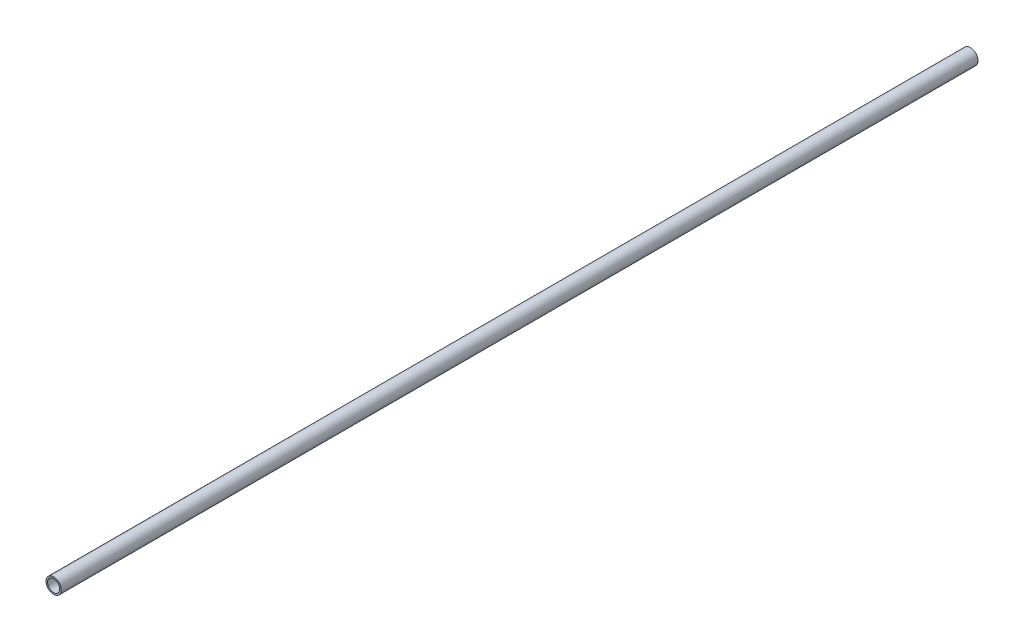
from build123d import *

# Parameters (mm, degrees)
SKETCH1_R           = 5
SKETCH1_R_2         = 4
BOSS_EXTRUDE1_DEPTH = 600


with BuildPart() as part:
    # Sketch1 → Boss-Extrude1 (new body)
    with BuildSketch(Plane.XY):
        Circle(SKETCH1_R)
        Circle(SKETCH1_R_2, mode=Mode.SUBTRACT)
    extrude(amount=BOSS_EXTRUDE1_DEPTH)


solid = part.part
